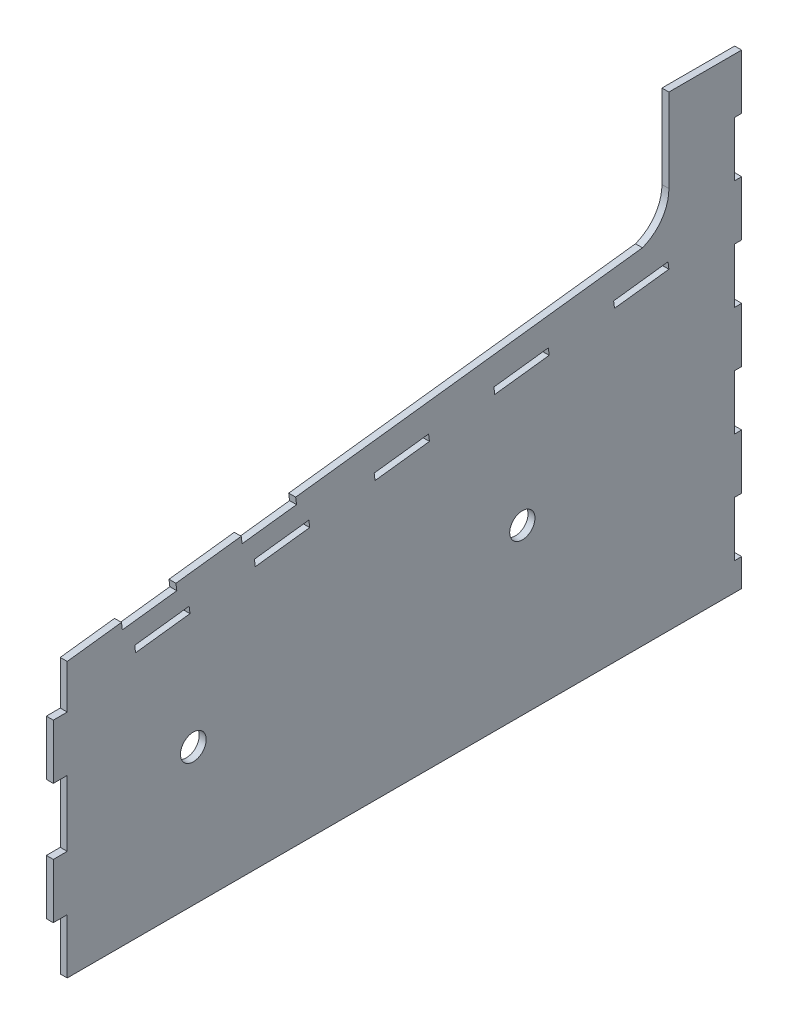
from build123d import *

# Parameters (mm, degrees)
BOSS_EXTRUDE1_DEPTH = 6.35
SKETCH2_R           = 11.5
SKETCH2_R_2         = 11.735
SKETCH2_W           = 6.35
SKETCH2_H           = 50
CUT_EXTRUDE1_DEPTH  = 6.35


with BuildPart() as part:
    # Sketch1 → Boss-Extrude1 (new body)
    with BuildSketch(Plane(origin=(0, 0, 0), x_dir=(0, 0, -1), z_dir=(1, 0, 0))):
        with BuildLine():
            Line((0, 0), (615, 0))
            Line((615, 0), (615, 425.32))
            Line((615, 425.32), (548.65, 425.32))
            Line((548.65, 425.32), (548.65, 349.09))
            ThreePointArc((548.65, 349.09), (542.027292182, 327.966077076), (524.529993531, 314.404184936))
            Line((524.529993531, 314.404184936), (0, 250))
            Line((0, 250), (0, 210))
            Line((0, 210), (-12.7, 210))
            Line((-12.7, 210), (-12.7, 160))
            Line((-12.7, 160), (0, 160))
            Line((0, 160), (0, 100))
            Line((0, 100), (-12.7, 100))
            Line((-12.7, 100), (-12.7, 50))
            Line((-12.7, 50), (0, 50))
            Line((0, 50), (0, 0))
        make_face()
    extrude(amount=BOSS_EXTRUDE1_DEPTH)

    # Sketch2 → Cut-Extrude1 (cut)
    with BuildSketch(Plane(origin=(6.35, 0, 0), x_dir=(0, 0, -1), z_dir=(1, 0, 0))):
        with Locations((415, 150)):
            Circle(SKETCH2_R)
        with Locations((115, 125)):
            Circle(SKETCH2_R_2)
        Polygon((208.316848977, 275.57809283), (158.689541395, 269.48462566), (159.463411726, 263.181957597), (209.090719308, 269.275424767), align=None)
        Polygon((61.537861402, 231.965149724), (62.311731732, 225.662481662), (111.939039314, 231.755948832), (111.165168984, 238.058616895), align=None)
        Polygon((220.345245664, 251.464244669), (170.717938082, 245.370777499), (171.491808413, 239.068109436), (221.119115995, 245.161576606), align=None)
        Polygon((329.525322345, 264.869872444), (279.898014763, 258.776405274), (280.671885093, 252.473737211), (330.299192675, 258.567204381), align=None)
        Polygon((438.705399025, 278.275500218), (389.078091443, 272.182033048), (389.851961774, 265.879364985), (439.479269356, 271.972832155), align=None)
        Polygon((547.885475706, 291.681127993), (498.258168124, 285.587660823), (499.032038454, 279.28499276), (548.659346036, 285.37845993), align=None)
        Polygon((49.509464714, 256.078997886), (50.283335045, 249.776329823), (99.910642627, 255.869796993), (99.136772297, 262.172465056), align=None)
        with Locations((611.825, 350.32)):
            Rectangle(SKETCH2_W, SKETCH2_H)
        with Locations((611.825, 250.32)):
            Rectangle(SKETCH2_W, SKETCH2_H)
        with Locations((611.825, 150.32)):
            Rectangle(SKETCH2_W, SKETCH2_H)
        with Locations((611.825, 50.32)):
            Rectangle(SKETCH2_W, SKETCH2_H)
    extrude(amount=-CUT_EXTRUDE1_DEPTH, mode=Mode.SUBTRACT)


solid = part.part
